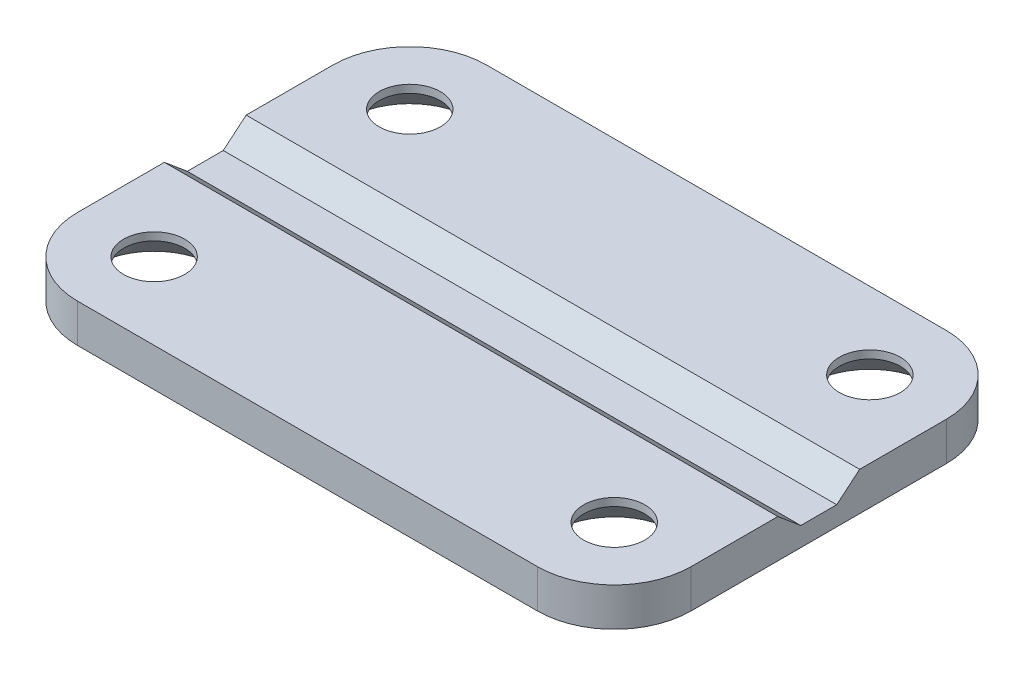
from build123d import *

# Parameters (mm, degrees)
EXTRUDE1_DEPTH                                = 19.05
CSK_FOR_6_FLAT_HEAD_MACHINE_SCREW1_AT_2_COUNT = 2
CSK_FOR_6_FLAT_HEAD_MACHINE_SCREW1_AT_2_PITCH = 32.688625698
CSK_FOR_6_FLAT_HEAD_MACHINE_SCREW1_AT_3_COUNT = 2
CSK_FOR_6_FLAT_HEAD_MACHINE_SCREW1_AT_3_PITCH = 28.575
CSK_FOR_6_FLAT_HEAD_MACHINE_SCREW1_AT_4_COUNT = 2
CSK_FOR_6_FLAT_HEAD_MACHINE_SCREW1_AT_4_PITCH = 15.875
FILLET1_R                                     = 4.7752
SKETCH6_R                                     = 3.5433
SKETCH6_R_2                                   = 1.89865
BOSS_EXTRUDE1_DEPTH                           = 2.3876
CHAMFER1_SIZE                                 = 1.89865


with BuildPart() as part:
    # Sketch2 → Extrude1 (new, symmetric)
    with BuildSketch(Plane(origin=(0, 0, 0), x_dir=(0, 0, -1), z_dir=(1, 0, 0))):
        Polygon((-12.7, 2.3876), (-2.54, 2.3876), (-1.117284561, 1.1938), (1.117284561, 1.1938), (2.54, 2.3876), (12.7, 2.3876), (12.7, 0), (-12.7, 0), align=None)
    extrude(amount=EXTRUDE1_DEPTH, both=True)

    # Sketch5 → CSK for #6 Flat Head Machine Screw1 (revolve, cut)
    with BuildSketch(Plane(origin=(-14.2875, 2.3876, 7.9375), x_dir=(0, 0, 1), z_dir=(1, 0, 0))):
        Polygon((0, 0), (0, 2.3876), (1.89865, 2.3876), (1.89865, 1.891953401), (3.5433, 0), align=None)
    csk_for_6_flat_head_machine_screw1 = revolve(axis=Axis((-14.2875, 8.7376, 7.9375), (0, -1, 0)), mode=Mode.SUBTRACT)

    # CSK for #6 Flat Head Machine Screw1 at 2: CSK for #6 Flat Head Machine Screw1 ×2
    with Locations(*[Vector(0.8741572761215377, 0, -0.4856429311786321) * (i * CSK_FOR_6_FLAT_HEAD_MACHINE_SCREW1_AT_2_PITCH) for i in range(1, CSK_FOR_6_FLAT_HEAD_MACHINE_SCREW1_AT_2_COUNT)]):
        add(csk_for_6_flat_head_machine_screw1, mode=Mode.SUBTRACT)

    # CSK for #6 Flat Head Machine Screw1 at 3: CSK for #6 Flat Head Machine Screw1 ×2
    with Locations(*[(i * CSK_FOR_6_FLAT_HEAD_MACHINE_SCREW1_AT_3_PITCH, 0, 0) for i in range(1, CSK_FOR_6_FLAT_HEAD_MACHINE_SCREW1_AT_3_COUNT)]):
        add(csk_for_6_flat_head_machine_screw1, mode=Mode.SUBTRACT)

    # CSK for #6 Flat Head Machine Screw1 at 4: CSK for #6 Flat Head Machine Screw1 ×2
    with Locations(*[(0, 0, -i * CSK_FOR_6_FLAT_HEAD_MACHINE_SCREW1_AT_4_PITCH) for i in range(1, CSK_FOR_6_FLAT_HEAD_MACHINE_SCREW1_AT_4_COUNT)]):
        add(csk_for_6_flat_head_machine_screw1, mode=Mode.SUBTRACT)

    # Fillet1
    fillet1_edges = [part.edges().sort_by_distance(p)[0] for p in [
        (19.05, 1.1938, -12.7),
        (-19.05, 1.1938, 12.7),
        (19.05, 1.1938, 12.7),
        (-19.05, 1.1938, -12.7),
    ]]
    fillet(fillet1_edges, radius=FILLET1_R)

    # Sketch6 → Boss-Extrude1 (add)
    # profile 1 of 4: a face of its own
    with BuildSketch(Plane(origin=(0, 2.3876, 0), x_dir=(1, 0, 0), z_dir=(0, 1, 0))):
        with Locations((-14.2875, -7.9375)):
            Circle(SKETCH6_R)
        with Locations(Location((-14.2875, -7.9375, 0), (0, 0, 270))):
            Circle(SKETCH6_R_2, mode=Mode.SUBTRACT)
    # profile 2 of 4: a face of its own
    with BuildSketch(Plane(origin=(0, 2.3876, 0), x_dir=(1, 0, 0), z_dir=(0, 1, 0))):
        with Locations((-14.2875, 7.9375)):
            Circle(SKETCH6_R)
        with Locations(Location((-14.2875, 7.9375, 0), (0, 0, 270))):
            Circle(SKETCH6_R_2, mode=Mode.SUBTRACT)
    # profile 3 of 4: a face of its own
    with BuildSketch(Plane(origin=(0, 2.3876, 0), x_dir=(1, 0, 0), z_dir=(0, 1, 0))):
        with Locations((14.2875, -7.9375)):
            Circle(SKETCH6_R)
        with Locations(Location((14.2875, -7.9375, 0), (0, 0, 270))):
            Circle(SKETCH6_R_2, mode=Mode.SUBTRACT)
    # profile 4 of 4: a face of its own
    with BuildSketch(Plane(origin=(0, 2.3876, 0), x_dir=(1, 0, 0), z_dir=(0, 1, 0))):
        with Locations((14.2875, 7.9375)):
            Circle(SKETCH6_R)
        with Locations(Location((14.2875, 7.9375, 0), (0, 0, 270))):
            Circle(SKETCH6_R_2, mode=Mode.SUBTRACT)
    extrude(amount=-BOSS_EXTRUDE1_DEPTH)

    # Chamfer1
    chamfer1_edges = [part.edges().sort_by_distance(p)[0] for p in [
        (-14.2875, 0, -9.83615),
        (14.2875, 0, 6.03885),
        (14.2875, 0, -9.83615),
        (-14.2875, 0, 6.03885),
    ]]
    chamfer(chamfer1_edges, length=CHAMFER1_SIZE)


solid = part.part
